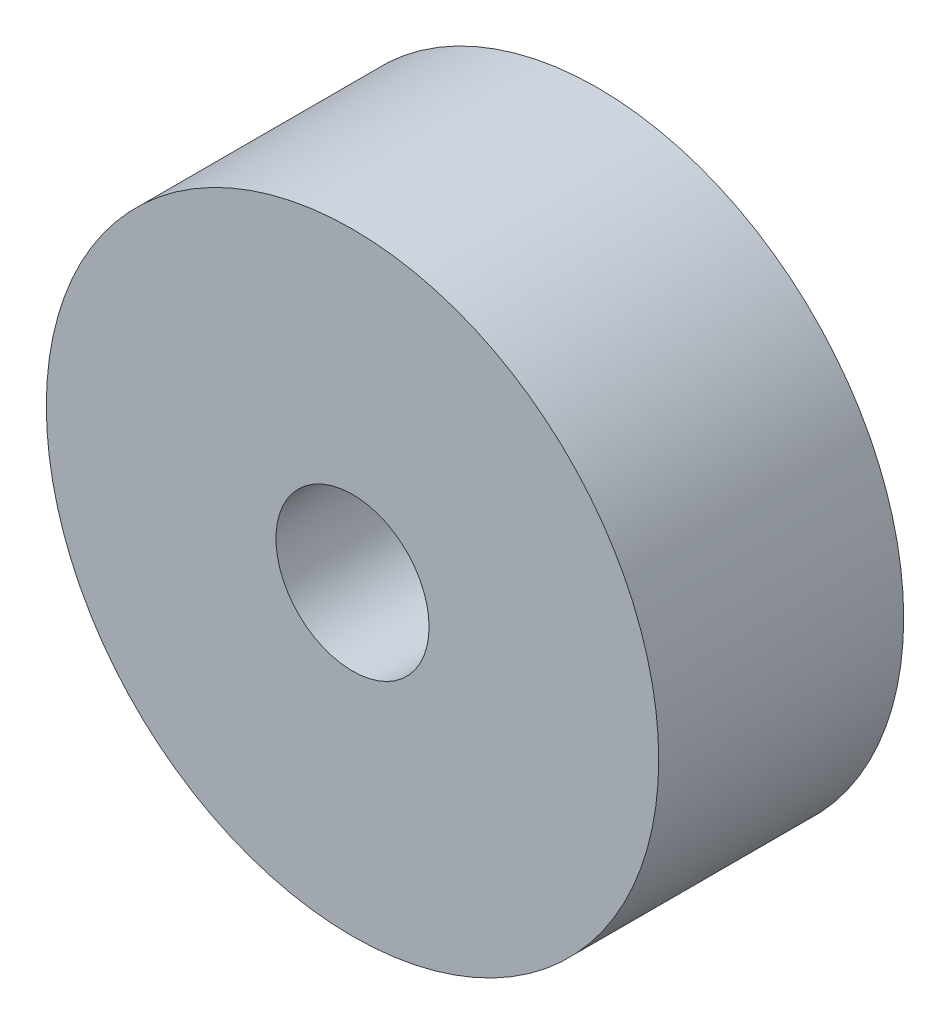
from build123d import *

# Parameters (mm, degrees)
SKETCH_1_R      = 10
SKETCH_1_R_2    = 2.5
EXTRUDE_1_DEPTH = 8


with BuildPart() as part:
    # 草图1 → 凸台-拉伸1 (new body)
    with BuildSketch(Plane.XY):
        Circle(SKETCH_1_R)
        Circle(SKETCH_1_R_2, mode=Mode.SUBTRACT)
    extrude(amount=EXTRUDE_1_DEPTH)


solid = part.part
